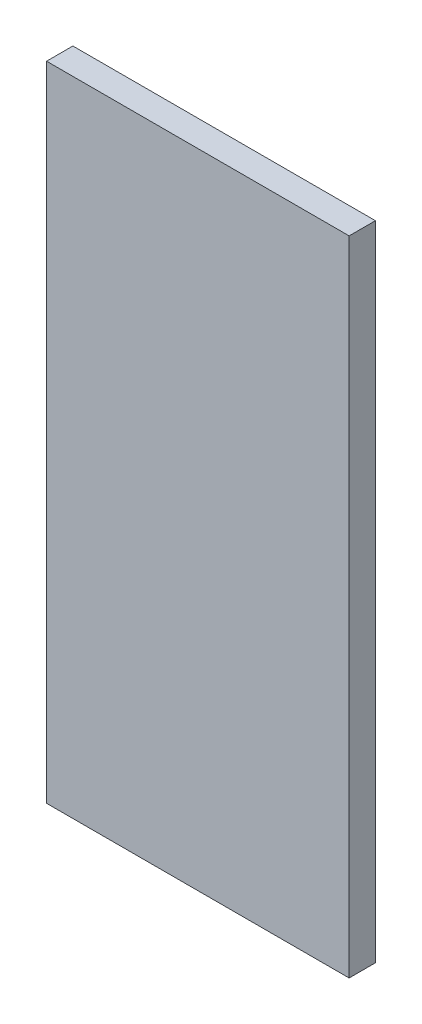
from build123d import *

# Parameters (mm, degrees)
SKETCH_1_W      = 161
SKETCH_1_H      = 342
EXTRUDE_1_DEPTH = 14


with BuildPart() as part:
    # 草图1 → 凸台-拉伸1 (new body)
    with BuildSketch(Plane.XY):
        Rectangle(SKETCH_1_W, SKETCH_1_H)
    extrude(amount=EXTRUDE_1_DEPTH)


solid = part.part
